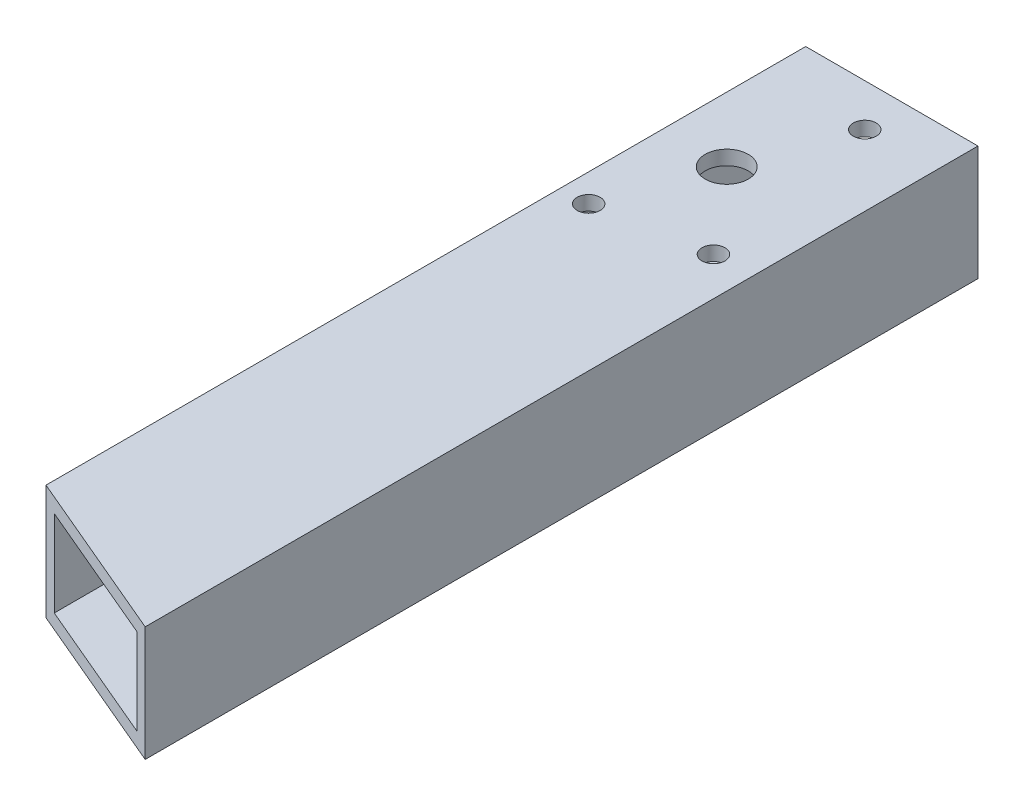
from build123d import *

# Parameters (mm, degrees)
SKETCH1_W           = 38.1
SKETCH1_H           = 25.4
SKETCH1_W_2         = 31.75
SKETCH1_H_2         = 19.05
BOSS_EXTRUDE1_DEPTH = 184.15
CUT_EXTRUDE1_REACH  = 188.867
CUT_EXTRUDE2_REACH  = 188.867
SKETCH3_R           = 4.7625
SKETCH3_R_2         = 2.54


with BuildPart() as part:
    # Sketch1 → Boss-Extrude1 (new body)
    with BuildSketch(Plane.XY):
        Rectangle(SKETCH1_W, SKETCH1_H)
        Rectangle(SKETCH1_W_2, SKETCH1_H_2, mode=Mode.SUBTRACT)
    extrude(amount=BOSS_EXTRUDE1_DEPTH)

    # Cut-Extrude1: up to this face of the body (flat: up to its plane)
    cut_extrude1_end = Plane(part.part.faces().sort_by_distance((0, -12.7, 92.075))[0])
    # Sketch2 → Cut-Extrude1 (cut, up to the picked face)
    with BuildSketch(Plane(origin=(0, 12.7, 0), x_dir=(1, 0, 0), z_dir=(0, 1, 0)), mode=Mode.PRIVATE) as cut_extrude1_sk1:
        Polygon((19.05, -184.15), (-19.05, -167.977509502), (-19.05, -184.15), align=None)
    cut_extrude1_tool1 = split(extrude(cut_extrude1_sk1.sketch, amount=-CUT_EXTRUDE1_REACH, mode=Mode.PRIVATE), bisect_by=cut_extrude1_end, keep=Keep.BOTH, mode=Mode.PRIVATE)
    add(cut_extrude1_tool1.solids().sort_by(Axis((-6.35, 12.7, 178.75917), (0, -1, 0)))[0], mode=Mode.SUBTRACT)

    # Cut-Extrude2: up to this face of the body (flat: up to its plane)
    cut_extrude2_end = Plane(part.part.faces().sort_by_distance((0.291642408, -12.7, 88.093774804))[0])
    # Sketch3 → Cut-Extrude2 (cut, up to the picked face)
    with BuildSketch(Plane(origin=(0, 12.7, 0), x_dir=(1, 0, 0), z_dir=(0, 1, 0)), mode=Mode.PRIVATE) as cut_extrude2_sk1:
        with Locations(Location((-4.7625, -31.75, 0), (0, 0, 270))):
            Circle(SKETCH3_R)
    cut_extrude2_tool1 = split(extrude(cut_extrude2_sk1.sketch, amount=-CUT_EXTRUDE2_REACH, mode=Mode.PRIVATE), bisect_by=cut_extrude2_end, keep=Keep.BOTH, mode=Mode.PRIVATE)
    # Sketch3 → Cut-Extrude2 (cut, up to the picked face)
    with BuildSketch(Plane(origin=(0, 12.7, 0), x_dir=(1, 0, 0), z_dir=(0, 1, 0)), mode=Mode.PRIVATE) as cut_extrude2_sk2:
        with Locations(Location((-12.906854663, -54.126430532, 0), (0, 0, 270))):
            Circle(SKETCH3_R_2)
    cut_extrude2_tool2 = split(extrude(cut_extrude2_sk2.sketch, amount=-CUT_EXTRUDE2_REACH, mode=Mode.PRIVATE), bisect_by=cut_extrude2_end, keep=Keep.BOTH, mode=Mode.PRIVATE)
    # Sketch3 → Cut-Extrude2 (cut, up to the picked face)
    with BuildSketch(Plane(origin=(0, 12.7, 0), x_dir=(1, 0, 0), z_dir=(0, 1, 0)), mode=Mode.PRIVATE) as cut_extrude2_sk3:
        with Locations(Location((3.381854663, -9.373569468, 0), (0, 0, 270))):
            Circle(SKETCH3_R_2)
    cut_extrude2_tool3 = split(extrude(cut_extrude2_sk3.sketch, amount=-CUT_EXTRUDE2_REACH, mode=Mode.PRIVATE), bisect_by=cut_extrude2_end, keep=Keep.BOTH, mode=Mode.PRIVATE)
    # Sketch3 → Cut-Extrude2 (cut, up to the picked face)
    with BuildSketch(Plane(origin=(0, 12.7, 0), x_dir=(1, 0, 0), z_dir=(0, 1, 0)), mode=Mode.PRIVATE) as cut_extrude2_sk4:
        with Locations(Location((10.543879956, -49.991433302, 0), (0, 0, 270))):
            Circle(SKETCH3_R_2)
    cut_extrude2_tool4 = split(extrude(cut_extrude2_sk4.sketch, amount=-CUT_EXTRUDE2_REACH, mode=Mode.PRIVATE), bisect_by=cut_extrude2_end, keep=Keep.BOTH, mode=Mode.PRIVATE)
    add(cut_extrude2_tool1.solids().sort_by(Axis((-4.7625, 12.7, 31.75), (0, -1, 0)))[0], mode=Mode.SUBTRACT)
    add(cut_extrude2_tool2.solids().sort_by(Axis((-12.906855, 12.7, 54.126431), (0, -1, 0)))[0], mode=Mode.SUBTRACT)
    add(cut_extrude2_tool3.solids().sort_by(Axis((3.381855, 12.7, 9.373569), (0, -1, 0)))[0], mode=Mode.SUBTRACT)
    add(cut_extrude2_tool4.solids().sort_by(Axis((10.54388, 12.7, 49.991433), (0, -1, 0)))[0], mode=Mode.SUBTRACT)


solid = part.part
